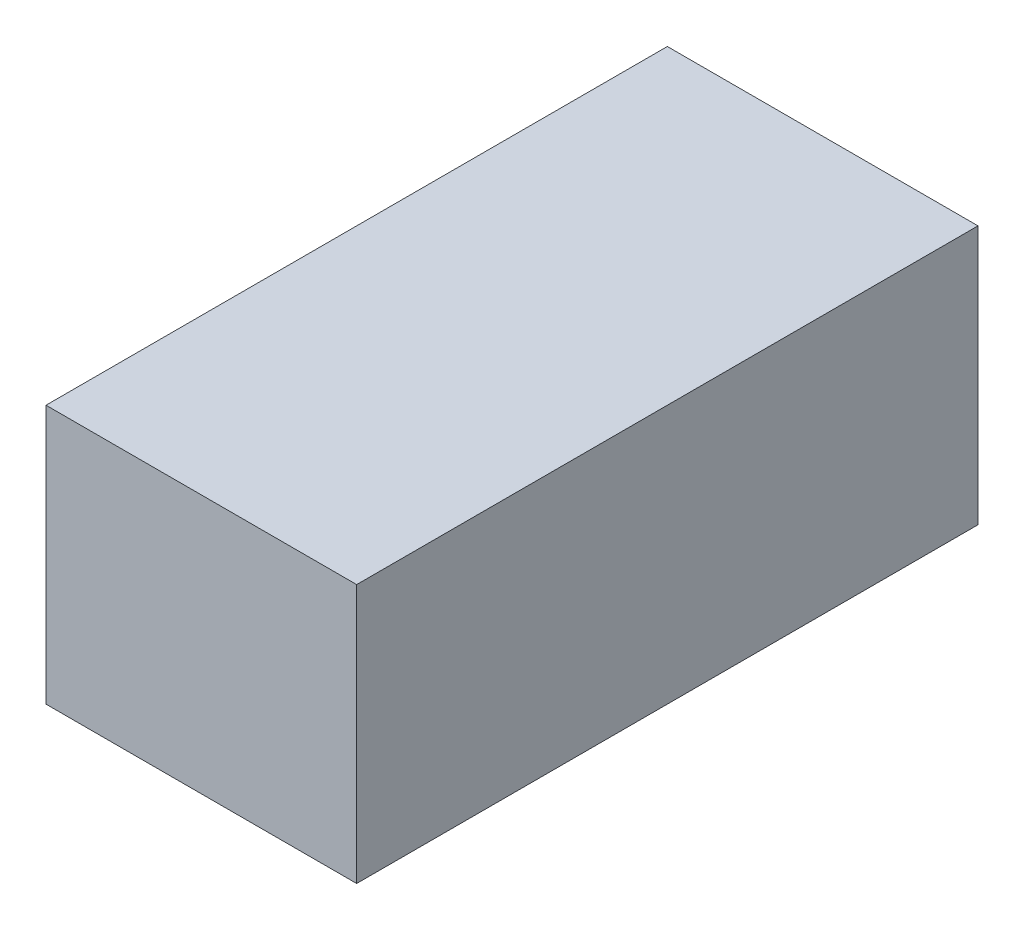
from build123d import *

# Parameters (mm, degrees)
SKETCH2_W      = 38.1
SKETCH2_H      = 76.2
EXTRUDE1_DEPTH = 31.75


with BuildPart() as part:
    # Sketch2 → Extrude1 (new body)
    with BuildSketch(Plane(origin=(0, 0, 0), x_dir=(1, 0, 0), z_dir=(0, 1, 0))):
        with Locations((0, 38.1)):
            Rectangle(SKETCH2_W, SKETCH2_H)
    extrude(amount=EXTRUDE1_DEPTH)


solid = part.part
